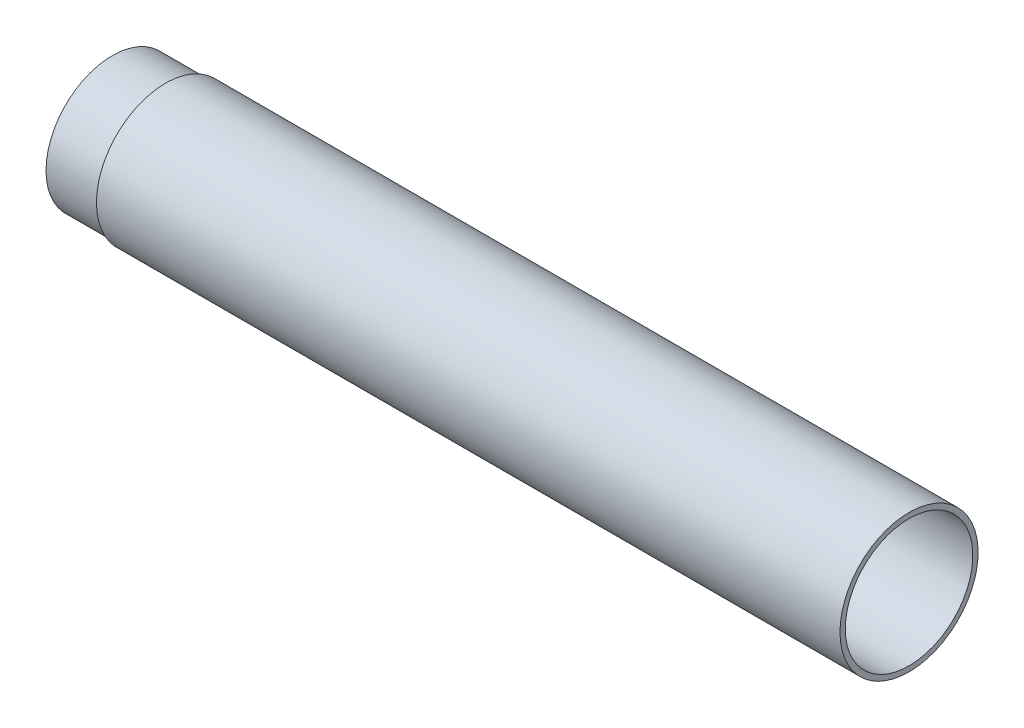
from build123d import *


with BuildPart() as part:
    # Sketch1 → Revolve1 (revolve)
    with BuildSketch(Plane.XY, mode=Mode.PRIVATE) as revolve1_sk:
        Polygon((15.248535153, 15.881577847), (2.548535153, 15.881577847), (2.548535153, 15.246577847), (193.048535153, 15.246577847), (193.048535153, 16.516577847), (15.248535153, 16.516577847), align=None)
    revolve(revolve1_sk.sketch.rotate(Axis((0, 0, 0), (1, 0, 0)), 90), axis=Axis((0, 0, 0), (1, 0, 0)))


solid = part.part
